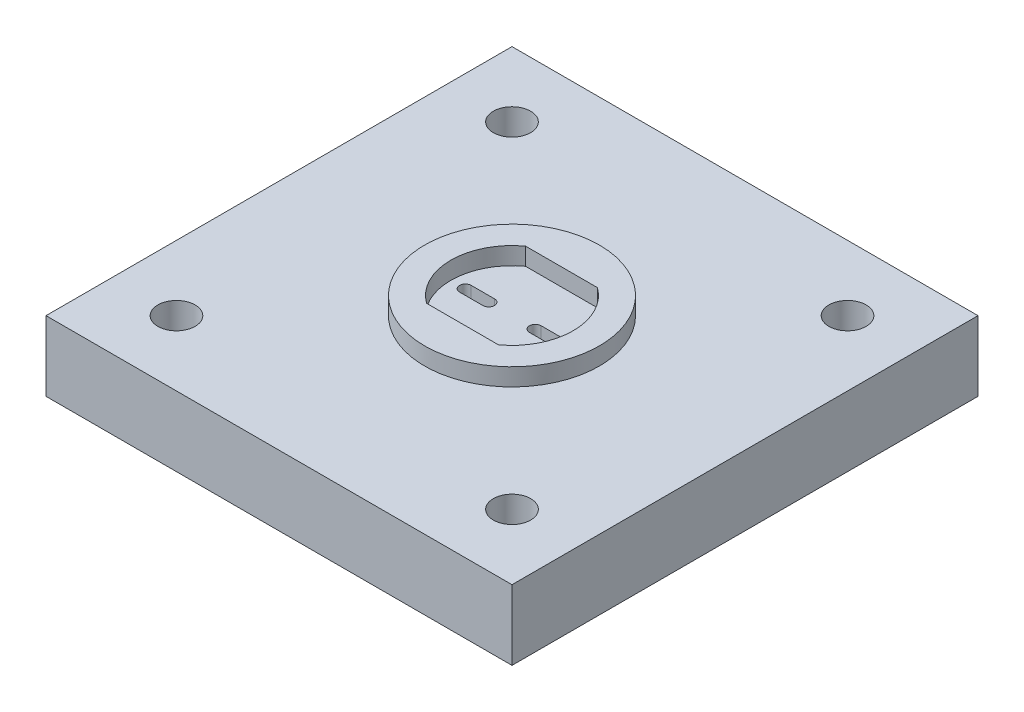
from build123d import *

# Parameters (mm, degrees)
SKETCH1_W           = 40
SKETCH1_H           = 40
SKETCH1_R           = 1.6
BOSS_EXTRUDE1_DEPTH = 6
SKETCH2_R           = 7.5
SKETCH2_R_2         = 5.25
BOSS_EXTRUDE2_DEPTH = 1.5
CUT_EXTRUDE1_DEPTH  = 21.5


with BuildPart() as part:
    # Sketch1 → Boss-Extrude1 (new body)
    with BuildSketch(Plane(origin=(0, 0, 0), x_dir=(1, 0, 0), z_dir=(0, 1, 0))):
        with Locations((20, 20)):
            Rectangle(SKETCH1_W, SKETCH1_H)
        with Locations(Location((5.6, 34.4, 0), (0, 0, 270))):
            Circle(SKETCH1_R, mode=Mode.SUBTRACT)
        with Locations(Location((5.6, 5.6, 0), (0, 0, 270))):
            Circle(SKETCH1_R, mode=Mode.SUBTRACT)
        with Locations(Location((34.4, 34.4, 0), (0, 0, 270))):
            Circle(SKETCH1_R, mode=Mode.SUBTRACT)
        with Locations(Location((34.4, 5.6, 0), (0, 0, 270))):
            Circle(SKETCH1_R, mode=Mode.SUBTRACT)
    extrude(amount=BOSS_EXTRUDE1_DEPTH)

    # Sketch2 → Boss-Extrude2 (add)
    # profile 1 of 3: a face of its own
    with BuildSketch(Plane(origin=(0, 6, 0), x_dir=(1, 0, 0), z_dir=(0, 1, 0))):
        with Locations(Location((20, 20, 0), (0, 0, 90))):
            Circle(SKETCH2_R)
        with Locations((20, 20)):
            Circle(SKETCH2_R_2, mode=Mode.SUBTRACT)
    # profile 2 of 3: a face of its own
    with BuildSketch(Plane(origin=(0, 6, 0), x_dir=(1, 0, 0), z_dir=(0, 1, 0))):
        with BuildLine():
            ThreePointArc((23.082207001, 24.25), (20, 25.25), (16.917792999, 24.25))
            Line((16.917792999, 24.25), (23.082207001, 24.25))
        make_face()
    # profile 3 of 3: a face of its own
    with BuildSketch(Plane(origin=(0, 6, 0), x_dir=(1, 0, 0), z_dir=(0, 1, 0))):
        with BuildLine():
            Line((23.082207001, 15.75), (16.917792999, 15.75))
            ThreePointArc((16.917792999, 15.75), (20, 14.75), (23.082207001, 15.75))
        make_face()
    extrude(amount=BOSS_EXTRUDE2_DEPTH)

    # Sketch4 → Cut-Extrude1 (cut)
    with BuildSketch(Plane(origin=(0, 6, 0), x_dir=(1, 0, 0), z_dir=(0, 1, 0))):
        with BuildLine():
            Line((16, 20.5), (18, 20.5))
            ThreePointArc((18, 20.5), (18.5, 20), (18, 19.5))
            Line((18, 19.5), (16, 19.5))
            ThreePointArc((16, 19.5), (15.5, 20), (16, 20.5))
        make_face()
        with BuildLine():
            Line((24, 19.5), (22, 19.5))
            ThreePointArc((22, 19.5), (21.5, 20), (22, 20.5))
            Line((22, 20.5), (24, 20.5))
            ThreePointArc((24, 20.5), (24.5, 20), (24, 19.5))
        make_face()
    extrude(amount=-CUT_EXTRUDE1_DEPTH, mode=Mode.SUBTRACT)


solid = part.part
